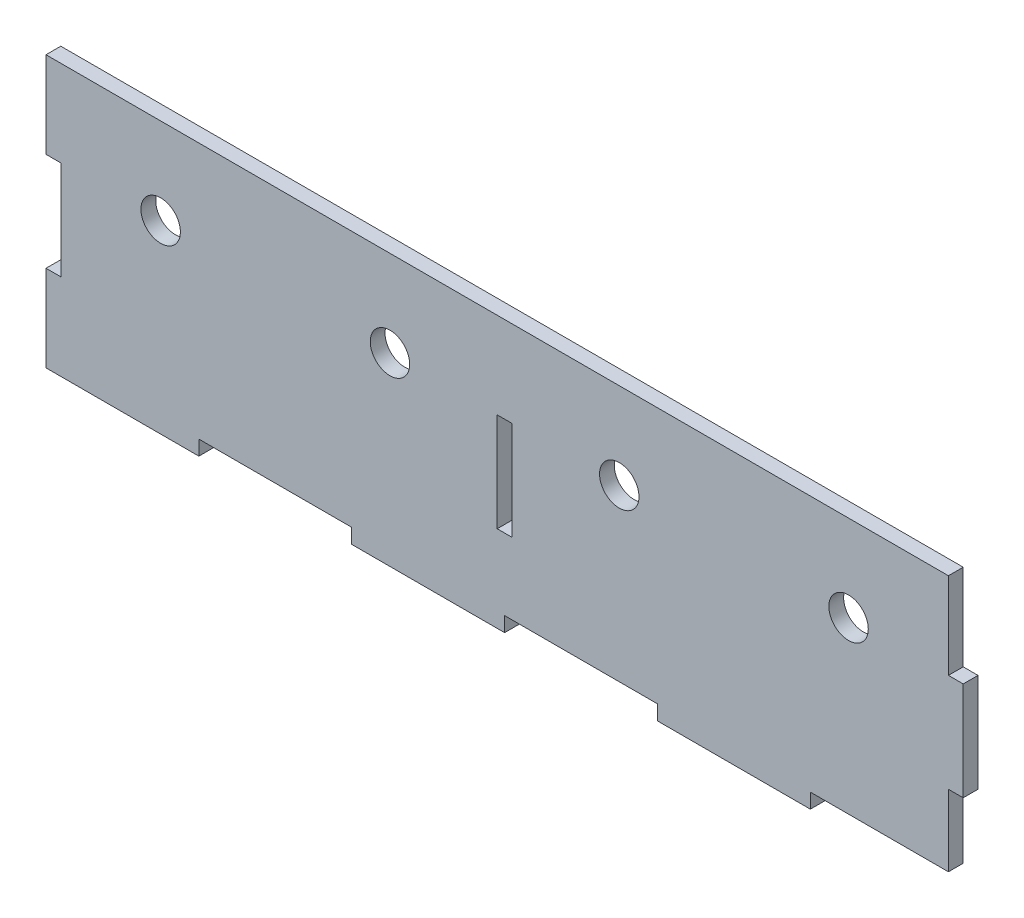
from build123d import *

# Parameters (mm, degrees)
SKETCH1_R           = 4
SKETCH1_W           = 3
SKETCH1_H           = 20
BOSS_EXTRUDE1_DEPTH = 3


with BuildPart() as part:
    # Sketch1 → Boss-Extrude1 (new body)
    with BuildSketch(Plane.XY):
        Polygon((-93, 27.5), (-93, 10), (-90, 10), (-90, -10), (-93, -10), (-93, -27.5), (-62, -27.5), (-62, -24.5), (-31, -24.5), (-31, -27.5), (0, -27.5), (0, -24.5), (31, -24.5), (31, -27.5), (62, -27.5), (62, -24.5), (90, -24.5), (90, -10), (93, -10), (93, 10), (90, 10), (90, 27.5), (0, 27.5), align=None)
        with Locations((-69.75, 10)):
            Circle(SKETCH1_R, mode=Mode.SUBTRACT)
        Rectangle(SKETCH1_W, SKETCH1_H, mode=Mode.SUBTRACT)
        with Locations((-23.25, 10)):
            Circle(SKETCH1_R, mode=Mode.SUBTRACT)
        with Locations((23.25, 10)):
            Circle(SKETCH1_R, mode=Mode.SUBTRACT)
        with Locations((69.75, 10)):
            Circle(SKETCH1_R, mode=Mode.SUBTRACT)
    extrude(amount=BOSS_EXTRUDE1_DEPTH)


solid = part.part
